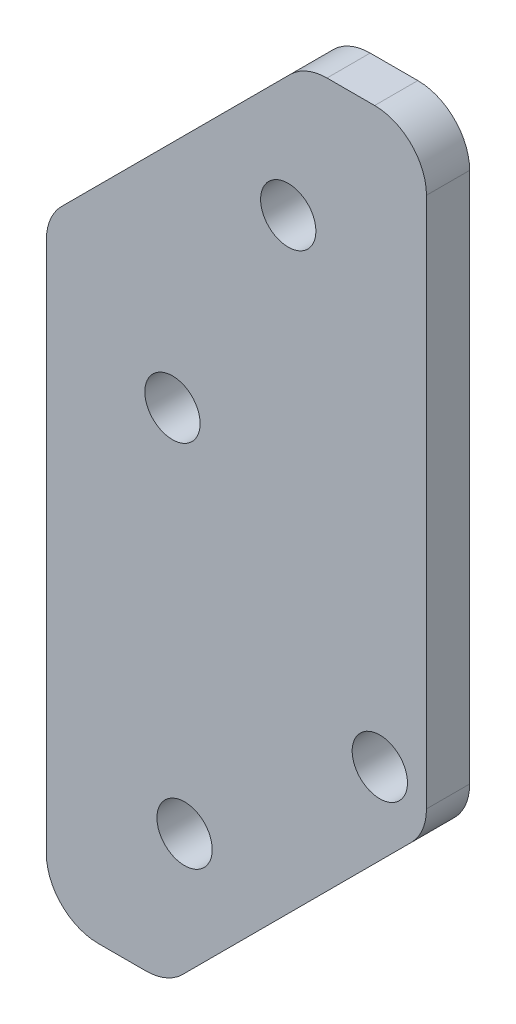
from build123d import *

# Parameters (mm, degrees)
SKETCH_1_W      = 22
SKETCH_1_H      = 50
SKETCH_1_R      = 1.6
EXTRUDE_1_DEPTH = 2.5
CHAMFER_1_SIZE  = 15
FILLET_1_R      = 3


with BuildPart() as part:
    # 草图1 → 凸台-拉伸1 (new body)
    with BuildSketch(Plane.XY):
        Rectangle(SKETCH_1_W, SKETCH_1_H)
        with Locations((-3, -17)):
            Circle(SKETCH_1_R, mode=Mode.SUBTRACT)
        with Locations((3, 17)):
            Circle(SKETCH_1_R, mode=Mode.SUBTRACT)
        with Locations((-3.7, 4)):
            Circle(SKETCH_1_R, mode=Mode.SUBTRACT)
        with Locations((8.3, -8)):
            Circle(SKETCH_1_R, mode=Mode.SUBTRACT)
    extrude(amount=EXTRUDE_1_DEPTH)

    # 倒角1
    chamfer_1_edges = [part.edges().sort_by_distance(p)[0] for p in [
        (11, -25, 1.25),
        (-11, 25, 1.25),
    ]]
    chamfer(chamfer_1_edges, length=CHAMFER_1_SIZE)

    # 圆角1
    fillet_1_edges = [part.edges().sort_by_distance(p)[0] for p in [
        (-11, 10, 1.25),
        (4, 25, 1.25),
        (11, -10, 1.25),
        (-4, -25, 1.25),
        (11, 25, 1.25),
        (-11, -25, 1.25),
    ]]
    fillet(fillet_1_edges, radius=FILLET_1_R)


solid = part.part
